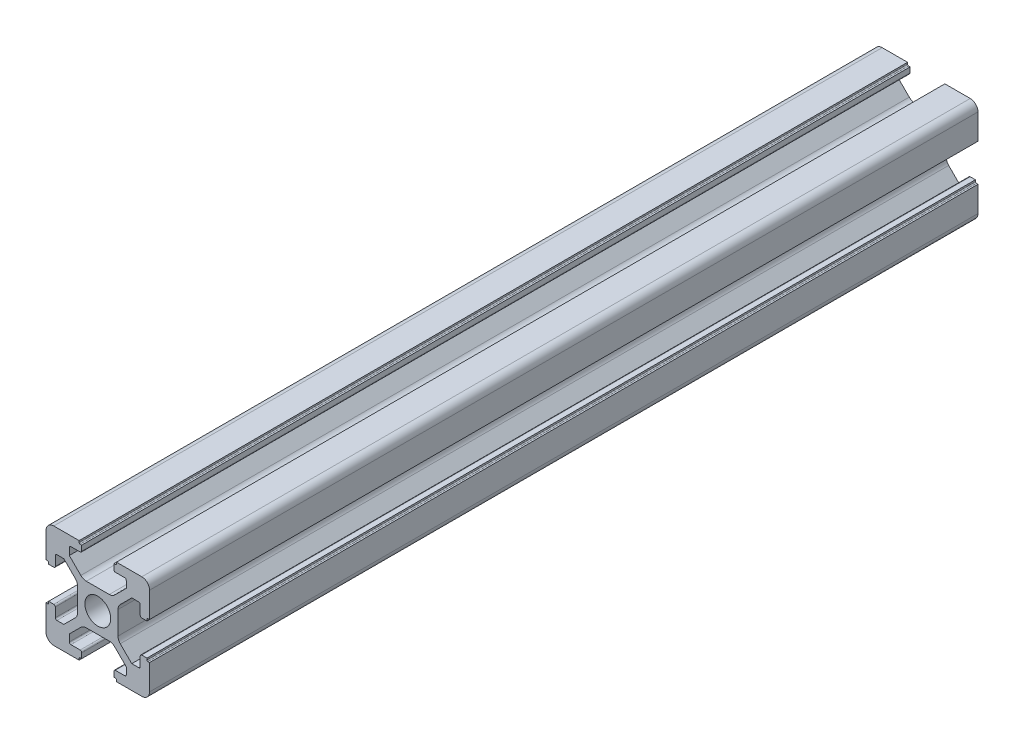
from build123d import *

# Parameters (mm, degrees)
SKETCH_1_R      = 2.5
EXTRUDE_1_DEPTH = 160


with BuildPart() as part:
    # 草图1 → 凸台-拉伸1 (new body)
    with BuildSketch(Plane.XY):
        with BuildLine():
            Line((4.215995631, 3.244230202), (6.436655803, 5.464890373))
            Line((6.436655803, 5.464890373), (7.776655803, 5.464890373))
            ThreePointArc((7.776655803, 5.464890373), (7.988787838, 5.377022408), (8.076655803, 5.164890373))
            Line((8.076655803, 5.164890373), (8.076655803, 3.364890373))
            ThreePointArc((8.076655803, 3.364890373), (8.164523769, 3.152758339), (8.376655803, 3.064890373))
            Line((8.376655803, 3.064890373), (9.376655803, 3.064890373))
            Line((9.376655803, 3.064890373), (9.376655803, 3.364890373))
            ThreePointArc((9.376655803, 3.364890373), (9.435234447, 3.50631173), (9.576655803, 3.564890373))
            Line((9.576655803, 3.564890373), (9.876655803, 3.564890373))
            Line((9.876655803, 3.564890373), (9.876655803, 8.464890373))
            ThreePointArc((9.876655803, 8.464890373), (9.437315975, 9.525550545), (8.376655803, 9.964890373))
            Line((8.376655803, 9.964890373), (3.476655803, 9.964890373))
            Line((3.476655803, 9.964890373), (3.476655803, 9.664890373))
            ThreePointArc((3.476655803, 9.664890373), (3.418077159, 9.523469017), (3.276655803, 9.464890373))
            Line((3.276655803, 9.464890373), (2.976655803, 9.464890373))
            Line((2.976655803, 9.464890373), (2.976655803, 8.464890373))
            ThreePointArc((2.976655803, 8.464890373), (3.064523769, 8.252758339), (3.276655803, 8.164890373))
            Line((3.276655803, 8.164890373), (5.076655803, 8.164890373))
            ThreePointArc((5.076655803, 8.164890373), (5.288787838, 8.077022408), (5.376655803, 7.864890373))
            Line((5.376655803, 7.864890373), (5.376655803, 6.524890373))
            Line((5.376655803, 6.524890373), (3.155995631, 4.304230202))
            ThreePointArc((3.155995631, 4.304230202), (2.669360608, 3.979071075), (2.09533546, 3.864890373))
            Line((2.09533546, 3.864890373), (-2.342023853, 3.864890373))
            ThreePointArc((-2.342023853, 3.864890373), (-2.916049002, 3.979071075), (-3.402684025, 4.304230202))
            Line((-3.402684025, 4.304230202), (-5.623344197, 6.524890373))
            Line((-5.623344197, 6.524890373), (-5.623344197, 7.864890373))
            ThreePointArc((-5.623344197, 7.864890373), (-5.535476231, 8.077022408), (-5.323344197, 8.164890373))
            Line((-5.323344197, 8.164890373), (-3.523344197, 8.164890373))
            ThreePointArc((-3.523344197, 8.164890373), (-3.311212162, 8.252758339), (-3.223344197, 8.464890373))
            Line((-3.223344197, 8.464890373), (-3.223344197, 9.464890373))
            Line((-3.223344197, 9.464890373), (-3.523344197, 9.464890373))
            ThreePointArc((-3.523344197, 9.464890373), (-3.664765553, 9.523469017), (-3.723344197, 9.664890373))
            Line((-3.723344197, 9.664890373), (-3.723344197, 9.964890373))
            Line((-3.723344197, 9.964890373), (-8.623344197, 9.964890373))
            ThreePointArc((-8.623344197, 9.964890373), (-9.684004369, 9.525550545), (-10.123344197, 8.464890373))
            Line((-10.123344197, 8.464890373), (-10.123344197, 3.564890373))
            Line((-10.123344197, 3.564890373), (-9.823344197, 3.564890373))
            ThreePointArc((-9.823344197, 3.564890373), (-9.681922841, 3.50631173), (-9.623344197, 3.364890373))
            Line((-9.623344197, 3.364890373), (-9.623344197, 3.064890373))
            Line((-9.623344197, 3.064890373), (-8.623344197, 3.064890373))
            ThreePointArc((-8.623344197, 3.064890373), (-8.411212162, 3.152758339), (-8.323344197, 3.364890373))
            Line((-8.323344197, 3.364890373), (-8.323344197, 5.164890373))
            ThreePointArc((-8.323344197, 5.164890373), (-8.235476231, 5.377022408), (-8.023344197, 5.464890373))
            Line((-8.023344197, 5.464890373), (-6.683344197, 5.464890373))
            Line((-6.683344197, 5.464890373), (-4.462684025, 3.244230202))
            ThreePointArc((-4.462684025, 3.244230202), (-4.137524898, 2.757595178), (-4.023344197, 2.18357003))
            Line((-4.023344197, 2.18357003), (-4.023344197, -2.253789283))
            ThreePointArc((-4.023344197, -2.253789283), (-4.137524898, -2.827814432), (-4.462684025, -3.314449455))
            Line((-4.462684025, -3.314449455), (-6.683344197, -5.535109627))
            Line((-6.683344197, -5.535109627), (-8.023344197, -5.535109627))
            ThreePointArc((-8.023344197, -5.535109627), (-8.235476231, -5.447241661), (-8.323344197, -5.235109627))
            Line((-8.323344197, -5.235109627), (-8.323344197, -3.435109627))
            ThreePointArc((-8.323344197, -3.435109627), (-8.411212162, -3.222977592), (-8.623344197, -3.135109627))
            Line((-8.623344197, -3.135109627), (-9.623344197, -3.135109627))
            Line((-9.623344197, -3.135109627), (-9.623344197, -3.435109627))
            ThreePointArc((-9.623344197, -3.435109627), (-9.681922841, -3.576530983), (-9.823344197, -3.635109627))
            Line((-9.823344197, -3.635109627), (-10.123344197, -3.635109627))
            Line((-10.123344197, -3.635109627), (-10.123344197, -8.535109627))
            ThreePointArc((-10.123344197, -8.535109627), (-9.684004369, -9.595769798), (-8.623344197, -10.035109627))
            Line((-8.623344197, -10.035109627), (-3.723344197, -10.035109627))
            Line((-3.723344197, -10.035109627), (-3.723344197, -9.735109627))
            ThreePointArc((-3.723344197, -9.735109627), (-3.664765553, -9.59368827), (-3.523344197, -9.535109627))
            Line((-3.523344197, -9.535109627), (-3.223344197, -9.535109627))
            Line((-3.223344197, -9.535109627), (-3.223344197, -8.535109627))
            ThreePointArc((-3.223344197, -8.535109627), (-3.311212162, -8.322977592), (-3.523344197, -8.235109627))
            Line((-3.523344197, -8.235109627), (-5.323344197, -8.235109627))
            ThreePointArc((-5.323344197, -8.235109627), (-5.535476231, -8.147241661), (-5.623344197, -7.935109627))
            Line((-5.623344197, -7.935109627), (-5.623344197, -6.595109627))
            Line((-5.623344197, -6.595109627), (-3.402684025, -4.374449455))
            ThreePointArc((-3.402684025, -4.374449455), (-2.916049002, -4.049290328), (-2.342023853, -3.935109627))
            Line((-2.342023853, -3.935109627), (2.09533546, -3.935109627))
            ThreePointArc((2.09533546, -3.935109627), (2.669360608, -4.049290328), (3.155995631, -4.374449455))
            Line((3.155995631, -4.374449455), (5.376655803, -6.595109627))
            Line((5.376655803, -6.595109627), (5.376655803, -7.935109627))
            ThreePointArc((5.376655803, -7.935109627), (5.288787838, -8.147241661), (5.076655803, -8.235109627))
            Line((5.076655803, -8.235109627), (3.276655803, -8.235109627))
            ThreePointArc((3.276655803, -8.235109627), (3.064523769, -8.322977592), (2.976655803, -8.535109627))
            Line((2.976655803, -8.535109627), (2.976655803, -9.535109627))
            Line((2.976655803, -9.535109627), (3.276655803, -9.535109627))
            ThreePointArc((3.276655803, -9.535109627), (3.418077159, -9.59368827), (3.476655803, -9.735109627))
            Line((3.476655803, -9.735109627), (3.476655803, -10.035109627))
            Line((3.476655803, -10.035109627), (8.376655803, -10.035109627))
            ThreePointArc((8.376655803, -10.035109627), (9.437315975, -9.595769798), (9.876655803, -8.535109627))
            Line((9.876655803, -8.535109627), (9.876655803, -3.635109627))
            Line((9.876655803, -3.635109627), (9.576655803, -3.635109627))
            ThreePointArc((9.576655803, -3.635109627), (9.435234447, -3.576530983), (9.376655803, -3.435109627))
            Line((9.376655803, -3.435109627), (9.376655803, -3.135109627))
            Line((9.376655803, -3.135109627), (8.376655803, -3.135109627))
            ThreePointArc((8.376655803, -3.135109627), (8.164523769, -3.222977592), (8.076655803, -3.435109627))
            Line((8.076655803, -3.435109627), (8.076655803, -5.235109627))
            ThreePointArc((8.076655803, -5.235109627), (7.988787838, -5.447241661), (7.776655803, -5.535109627))
            Line((7.776655803, -5.535109627), (6.436655803, -5.535109627))
            Line((6.436655803, -5.535109627), (4.215995631, -3.314449455))
            ThreePointArc((4.215995631, -3.314449455), (3.890836504, -2.827814432), (3.776655803, -2.253789283))
            Line((3.776655803, -2.253789283), (3.776655803, 2.18357003))
            ThreePointArc((3.776655803, 2.18357003), (3.890836504, 2.757595178), (4.215995631, 3.244230202))
        make_face()
        with Locations((-0.123344197, -0.035109627)):
            Circle(SKETCH_1_R, mode=Mode.SUBTRACT)
    extrude(amount=EXTRUDE_1_DEPTH)


solid = part.part
